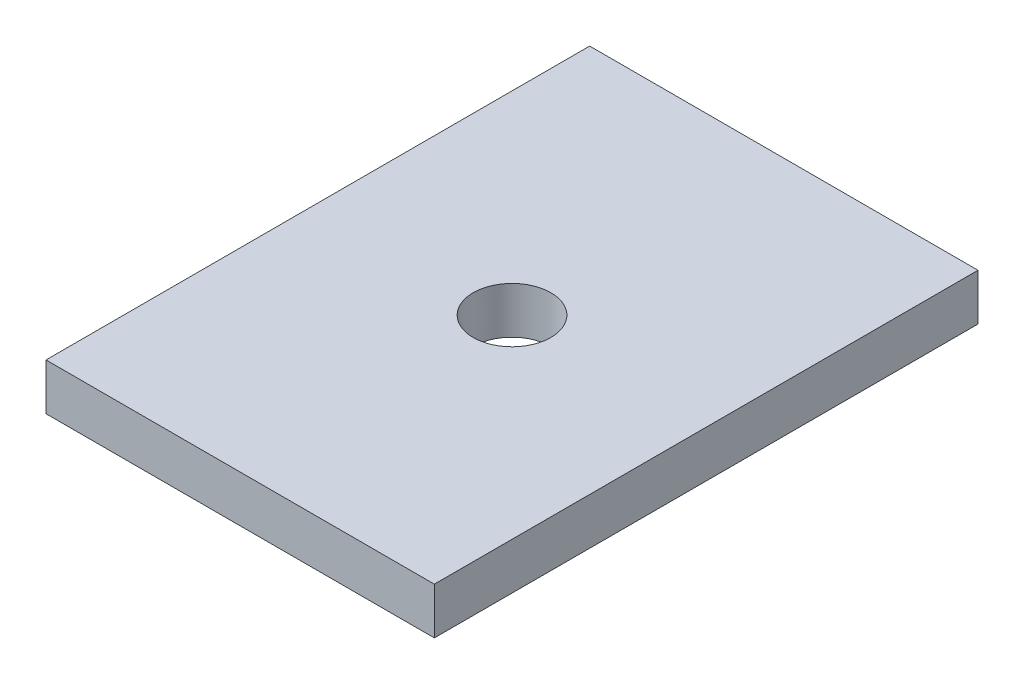
from build123d import *

# Parameters (mm, degrees)
SKETCH1_W           = 25
SKETCH1_H           = 35
BOSS_EXTRUDE1_DEPTH = 3
SKETCH2_R           = 2.5
CUT_EXTRUDE1_DEPTH  = 12


with BuildPart() as part:
    # Sketch1 → Boss-Extrude1 (new body)
    with BuildSketch(Plane(origin=(0, 0, 0), x_dir=(1, 0, 0), z_dir=(0, 1, 0))):
        with Locations((12.5, 17.5)):
            Rectangle(SKETCH1_W, SKETCH1_H)
    extrude(amount=BOSS_EXTRUDE1_DEPTH)

    # Sketch2 → Cut-Extrude1 (cut)
    with BuildSketch(Plane(origin=(0, 0, 0), x_dir=(1, 0, 0), z_dir=(0, 1, 0))):
        with Locations(Location((12.5, 17.5, 0), (0, 0, 90))):
            Circle(SKETCH2_R)
    extrude(amount=CUT_EXTRUDE1_DEPTH, mode=Mode.SUBTRACT)


solid = part.part
